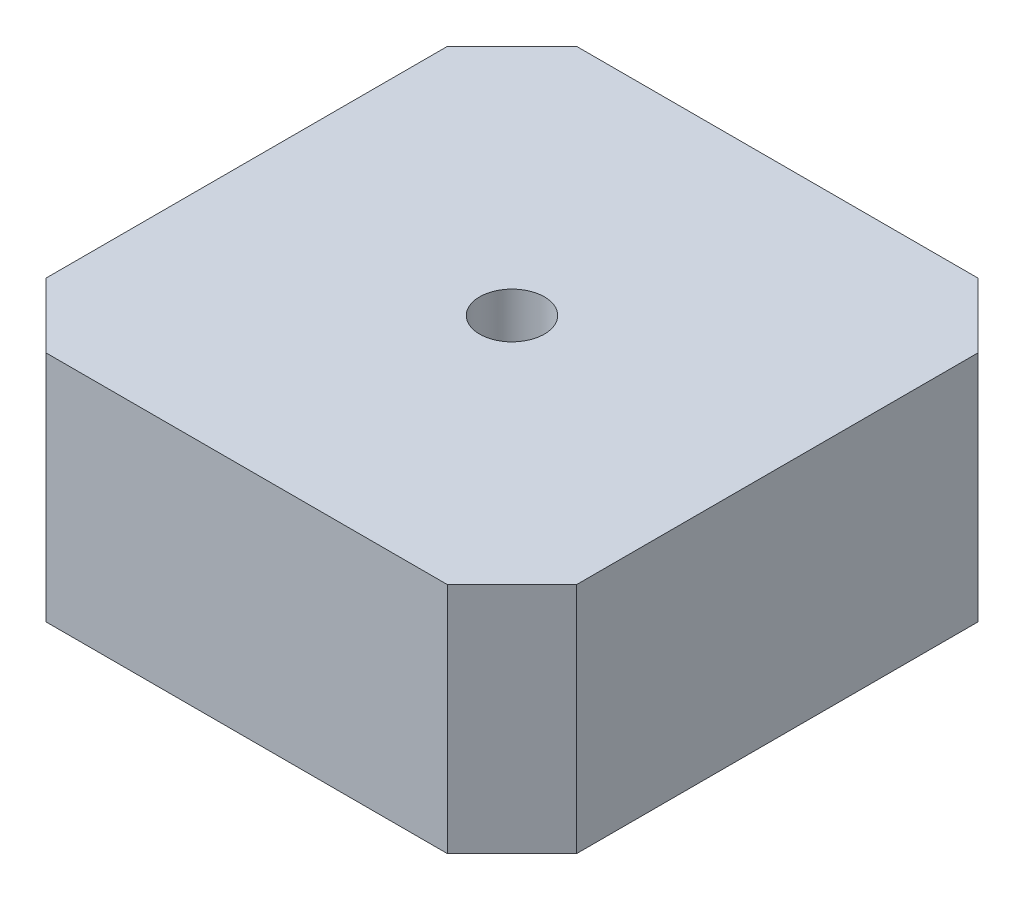
from build123d import *

# Parameters (mm, degrees)
SKETCH1_R           = 2.5
BOSS_EXTRUDE1_DEPTH = 28
SKETCH2_W           = 46.067929507
SKETCH2_H           = 54.310700194
CUT_EXTRUDE1_DEPTH  = 10


with BuildPart() as part:
    # Sketch1 → Boss-Extrude1 (new body)
    with BuildSketch(Plane(origin=(0, 0, 0), x_dir=(1, 0, 0), z_dir=(0, 1, 0))):
        Polygon((5, 0), (36, 0), (41, 5), (41, 36), (36, 41), (5, 41), (0, 36), (0, 5), align=None)
        with Locations(Location((20.5, 20.5, 0), (0, 0, 270))):
            Circle(SKETCH1_R, mode=Mode.SUBTRACT)
    extrude(amount=BOSS_EXTRUDE1_DEPTH)

    # Sketch2 → Cut-Extrude1 (cut)
    with BuildSketch(Plane(origin=(0, 28, 0), x_dir=(1, 0, 0), z_dir=(0, 1, 0))):
        with Locations((20.912138535, 21.370070239)):
            Rectangle(SKETCH2_W, SKETCH2_H)
    extrude(amount=-CUT_EXTRUDE1_DEPTH, mode=Mode.SUBTRACT)


solid = part.part
